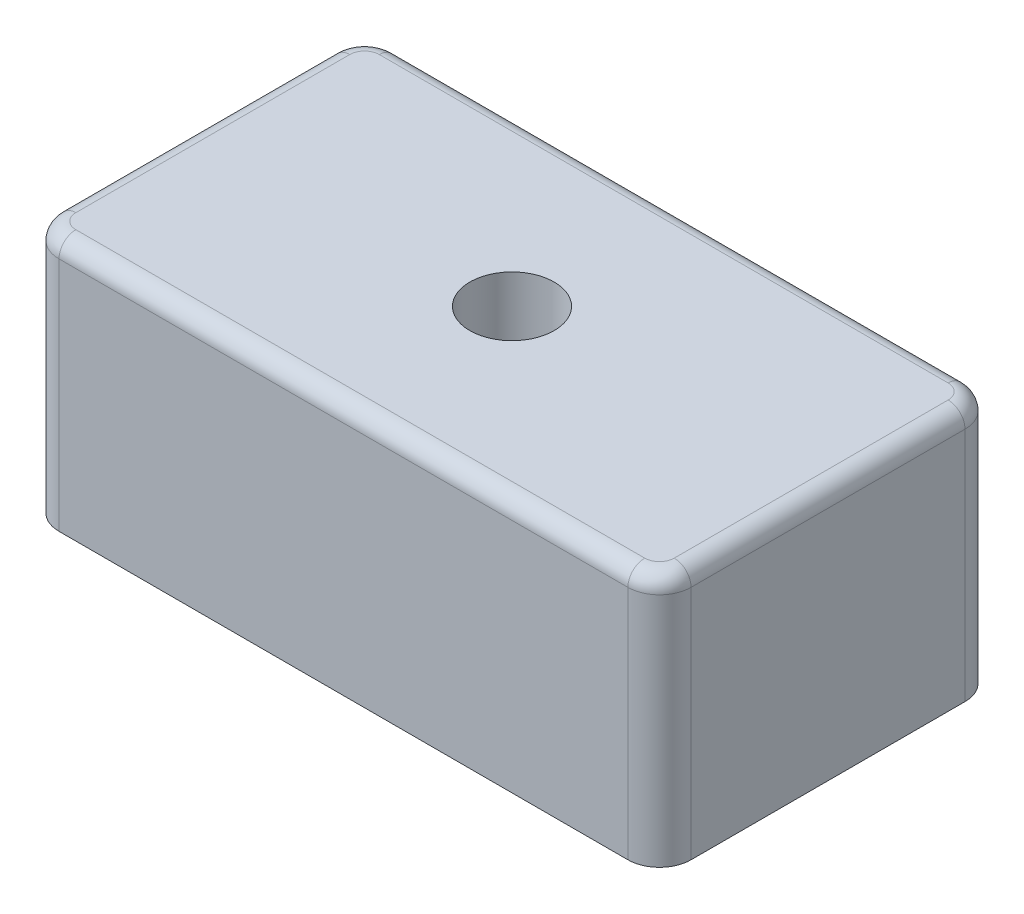
from build123d import *

# Parameters (mm, degrees)
SKETCH2_W           = 30
SKETCH2_H           = 16
BOSS_EXTRUDE1_DEPTH = 12
SKETCH3_R           = 2
CUT_EXTRUDE1_DEPTH  = 21.808652047
FILLET1_R           = 1.5
FILLET2_R           = 0.8


with BuildPart() as part:
    # Sketch2 → Boss-Extrude1 (new body)
    with BuildSketch(Plane(origin=(0, 0, 0), x_dir=(1, 0, 0), z_dir=(0, 1, 0))):
        Rectangle(SKETCH2_W, SKETCH2_H)
    extrude(amount=BOSS_EXTRUDE1_DEPTH)

    # Sketch3 → Cut-Extrude1 (cut, through all)
    with BuildSketch(Plane(origin=(0, 12, 0), x_dir=(1, 0, 0), z_dir=(0, 1, 0))):
        with Locations(Location((0, 0, 0), (0, 0, 270))):
            Circle(SKETCH3_R)
    extrude(amount=-CUT_EXTRUDE1_DEPTH, mode=Mode.SUBTRACT)

    # Fillet1
    fillet1_edges = [part.edges().sort_by_distance(p)[0] for p in [
        (15, 6, 8),
        (-15, 6, 8),
        (-15, 6, -8),
        (15, 6, -8),
    ]]
    fillet(fillet1_edges, radius=FILLET1_R)

    # Fillet2
    fillet2_edges = [part.edges().sort_by_distance(p)[0] for p in [
        (0, 12, 8),
        (-15, 12, 0),
        (15, 12, 0),
        (0, 12, -8),
        (14.560660172, 12, 7.560660172),
        (14.560660172, 12, -7.560660172),
        (-14.560660172, 12, -7.560660172),
        (-14.560660172, 12, 7.560660172),
    ]]
    fillet(fillet2_edges, radius=FILLET2_R)


solid = part.part
